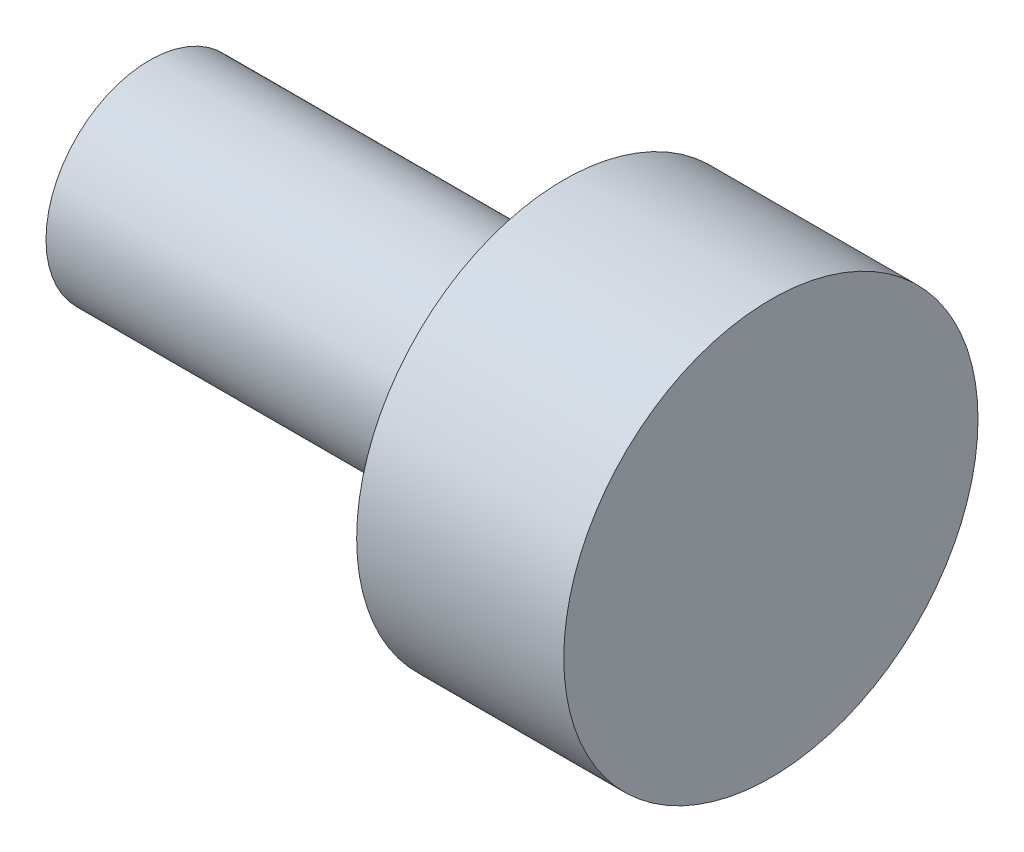
from build123d import *

# Parameters (mm, degrees)
SKETCH2_W          = 2.386092155
SKETCH2_H          = 2.248872797
CUT_EXTRUDE1_DEPTH = 3
SKETCH3_W          = 2.355598965
SKETCH3_H          = 2.325105774
CUT_EXTRUDE2_DEPTH = 4


with BuildPart() as part:
    # Sketch1 → Revolve1 (revolve)
    with BuildSketch(Plane.XY, mode=Mode.PRIVATE) as revolve1_sk:
        Polygon((-116.835752997, 27.175404574), (-105.835752997, 27.175404574), (-105.835752997, 28.175404574), (-103.835752997, 28.175404574), (-103.835752997, 26.175404574), (-116.835752997, 26.175404574), align=None)
    revolve(revolve1_sk.sketch.rotate(Axis((-116.835752997, 26.175404574, 0), (1, 0, 0)), 90), axis=Axis((-116.835752997, 26.175404574, 0), (1, 0, 0)))

    # Sketch2 → Cut-Extrude1 (cut)
    with BuildSketch(Plane.ZY.offset(116.835752997)):
        with Locations((0.019058245, 26.198274467)):
            Rectangle(SKETCH2_W, SKETCH2_H)
    extrude(amount=-CUT_EXTRUDE1_DEPTH, mode=Mode.SUBTRACT)

    # Sketch3 → Cut-Extrude2 (cut)
    with BuildSketch(Plane.ZY.offset(113.835752997)):
        with Locations((-0.034304839, 26.259260848)):
            Rectangle(SKETCH3_W, SKETCH3_H)
    extrude(amount=-CUT_EXTRUDE2_DEPTH, mode=Mode.SUBTRACT)


solid = part.part
